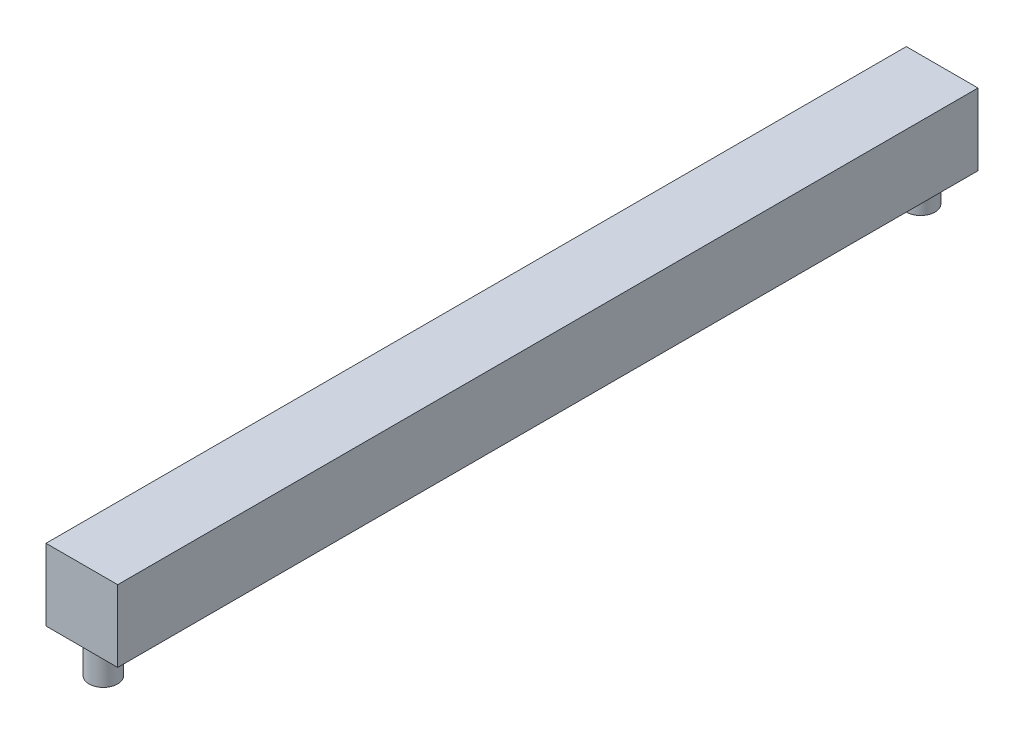
from build123d import *

# Parameters (mm, degrees)
SKETCH1_W           = 10
SKETCH1_H           = 120
BOSS_EXTRUDE1_DEPTH = 10
SKETCH2_R           = 2
BOSS_EXTRUDE2_DEPTH = 5


with BuildPart() as part:
    # Sketch1 → Boss-Extrude1 (new body)
    with BuildSketch(Plane(origin=(0, 0, 0), x_dir=(1, 0, 0), z_dir=(0, 1, 0))):
        with Locations((1.605585851, -7.639883399)):
            Rectangle(SKETCH1_W, SKETCH1_H)
    extrude(amount=BOSS_EXTRUDE1_DEPTH)

    # Sketch2 → Boss-Extrude2 (add)
    with BuildSketch(Plane(origin=(0, 0, 0), x_dir=(-1, 0, 0), z_dir=(0, -1, 0))):
        with Locations(Location((-1.605585851, 49.360116601, 0), (0, 0, 270))):
            Circle(SKETCH2_R)
        with Locations(Location((-1.605585851, -64.639883399, 0), (0, 0, 270))):
            Circle(SKETCH2_R)
    extrude(amount=BOSS_EXTRUDE2_DEPTH)


solid = part.part
